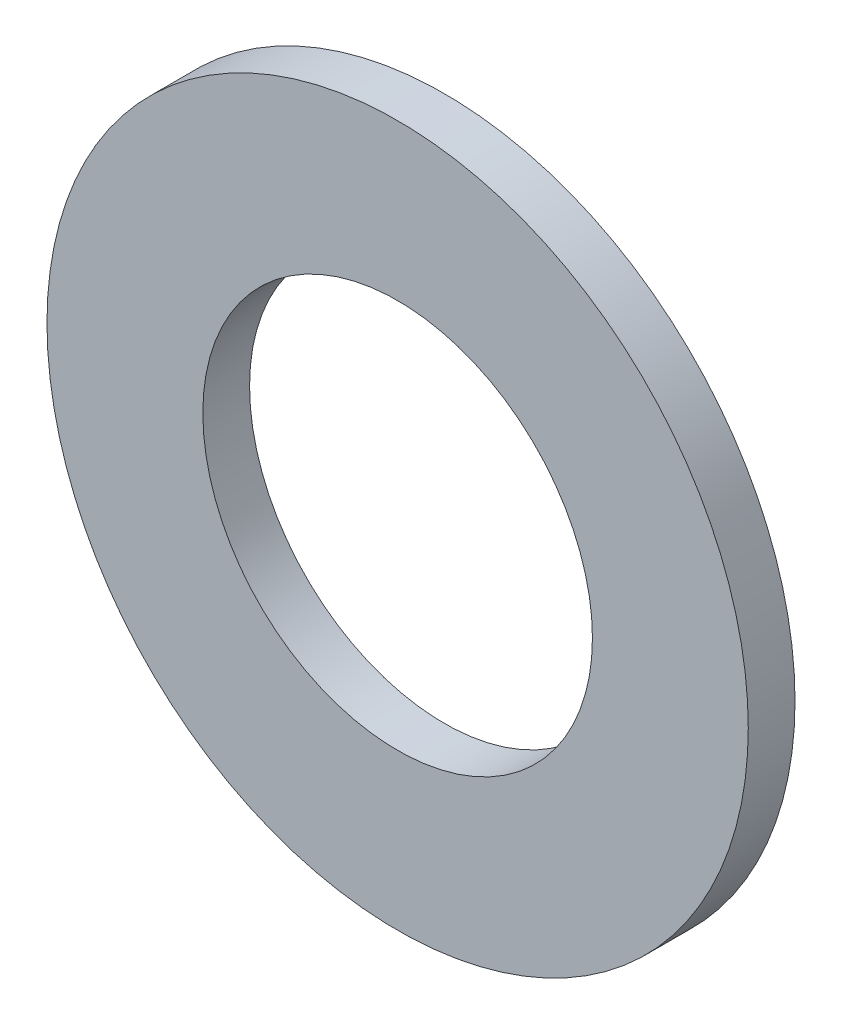
from build123d import *

# Parameters (mm, degrees)
SKETCH1_R           = 22.5
SKETCH1_R_2         = 12.5
BOSS_EXTRUDE1_DEPTH = 3


with BuildPart() as part:
    # Sketch1 → Boss-Extrude1 (new body)
    with BuildSketch(Plane.XY):
        Circle(SKETCH1_R)
        Circle(SKETCH1_R_2, mode=Mode.SUBTRACT)
    extrude(amount=BOSS_EXTRUDE1_DEPTH)


solid = part.part
